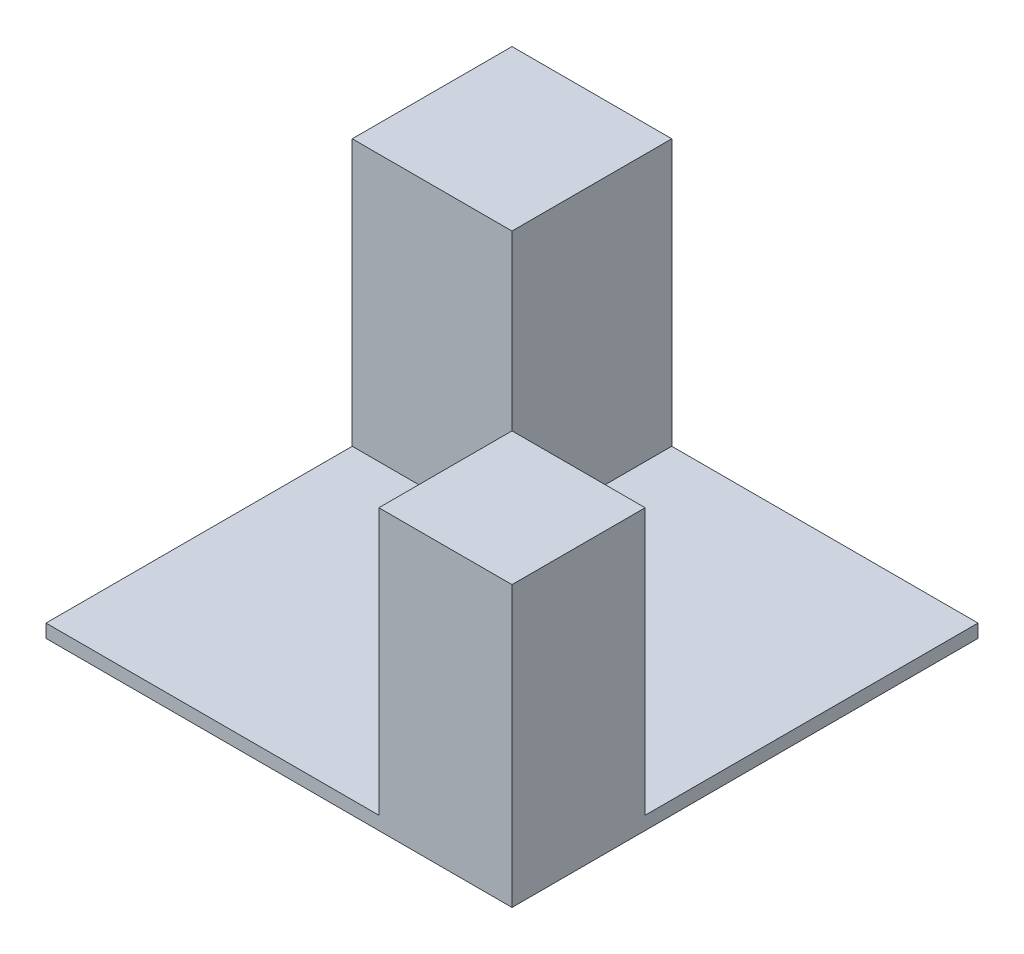
from build123d import *

# Parameters (mm, degrees)
SKETCH1_W           = 35
SKETCH1_H           = 35
BOSS_EXTRUDE1_DEPTH = 1
SKETCH2_W           = 12
SKETCH2_H           = 12
SKETCH2_W_2         = 10
SKETCH2_H_2         = 10
BOSS_EXTRUDE2_DEPTH = 20


with BuildPart() as part:
    # Sketch1 → Boss-Extrude1 (new body)
    with BuildSketch(Plane(origin=(0, 0, 0), x_dir=(1, 0, 0), z_dir=(0, 1, 0))):
        with Locations((17.5, 17.5)):
            Rectangle(SKETCH1_W, SKETCH1_H)
    extrude(amount=BOSS_EXTRUDE1_DEPTH)

    # Sketch2 → Boss-Extrude2 (add)
    with BuildSketch(Plane(origin=(0, 1, 0), x_dir=(1, 0, 0), z_dir=(0, 1, 0))):
        with Locations((6, 29)):
            Rectangle(SKETCH2_W, SKETCH2_H)
        with Locations((30, 5)):
            Rectangle(SKETCH2_W_2, SKETCH2_H_2)
    extrude(amount=BOSS_EXTRUDE2_DEPTH)


solid = part.part
